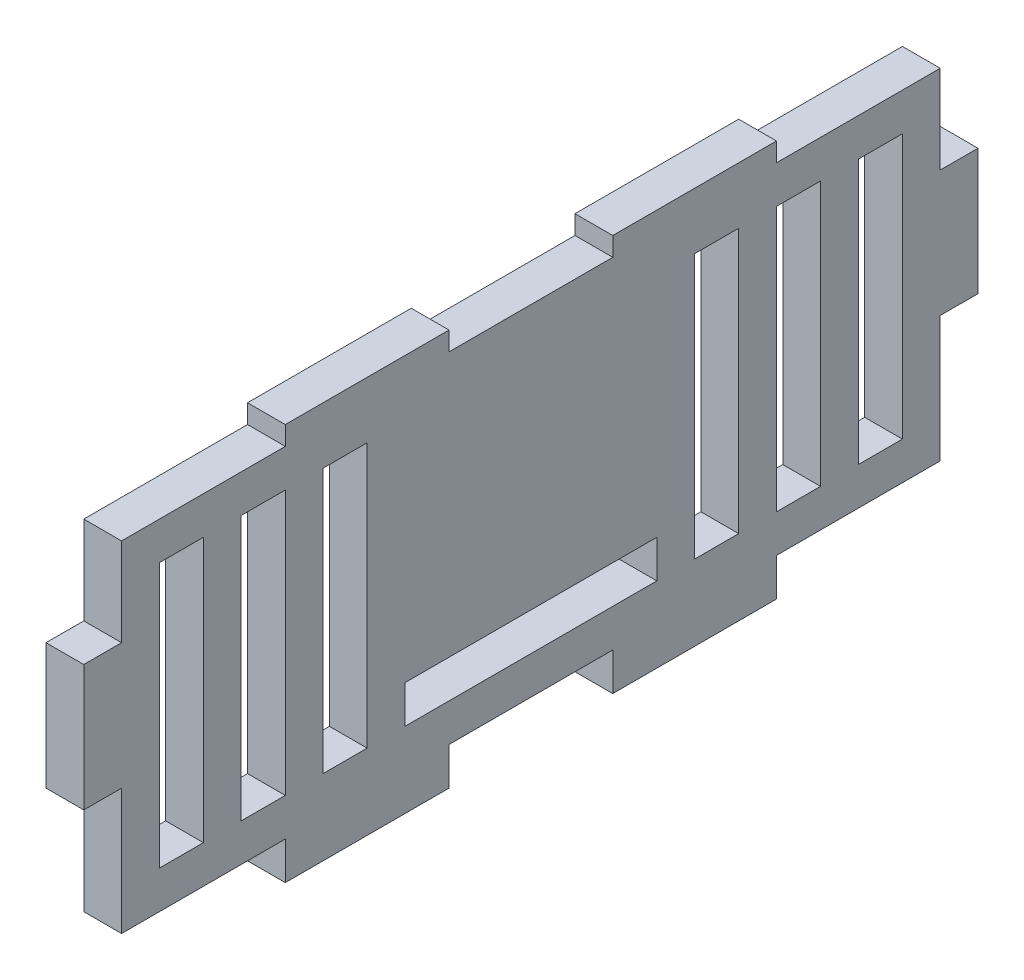
from build123d import *

# Parameters (mm, degrees)
SKETCH1_W           = 7
SKETCH1_H           = 42
SKETCH1_W_2         = 40
SKETCH1_H_2         = 6
BOSS_EXTRUDE1_DEPTH = 6


with BuildPart() as part:
    # Sketch1 → Boss-Extrude1 (new body)
    with BuildSketch(Plane(origin=(0, 0, 0), x_dir=(0, 0, -1), z_dir=(1, 0, 0))):
        Polygon((-46.246943765, 21.420537897), (-20.246943765, 21.420537897), (-20.246943765, 24.420537897), (5.753056235, 24.420537897), (5.753056235, 21.420537897), (31.753056235, 21.420537897), (31.753056235, 24.420537897), (57.753056235, 24.420537897), (57.753056235, 21.420537897), (83.753056235, 21.420537897), (83.753056235, 7.420537897), (89.753056235, 7.420537897), (89.753056235, -12.579462103), (83.753056235, -12.579462103), (83.753056235, -32.579462103), (57.753056235, -32.579462103), (57.753056235, -38.579462103), (31.753056235, -38.579462103), (31.753056235, -32.579462103), (5.753056235, -32.579462103), (5.753056235, -38.579462103), (-20.246943765, -38.579462103), (-20.246943765, -32.579462103), (-46.246943765, -32.579462103), (-46.246943765, -12.579462103), (-52.246943765, -12.579462103), (-52.246943765, 7.420537897), (-46.246943765, 7.420537897), align=None)
        with Locations((-36.746943765, -5.579462103)):
            Rectangle(SKETCH1_W, SKETCH1_H, mode=Mode.SUBTRACT)
        with Locations((48.253056235, -5.579462103)):
            Rectangle(SKETCH1_W, SKETCH1_H, mode=Mode.SUBTRACT)
        with Locations((-23.746943765, -5.579462103)):
            Rectangle(SKETCH1_W, SKETCH1_H, mode=Mode.SUBTRACT)
        with Locations((-10.746943765, -5.579462103)):
            Rectangle(SKETCH1_W, SKETCH1_H, mode=Mode.SUBTRACT)
        with Locations((18.753056235, -23.579462103)):
            Rectangle(SKETCH1_W_2, SKETCH1_H_2, mode=Mode.SUBTRACT)
        with Locations((61.253056235, -5.579462103)):
            Rectangle(SKETCH1_W, SKETCH1_H, mode=Mode.SUBTRACT)
        with Locations((74.253056235, -5.579462103)):
            Rectangle(SKETCH1_W, SKETCH1_H, mode=Mode.SUBTRACT)
    extrude(amount=BOSS_EXTRUDE1_DEPTH)


solid = part.part
